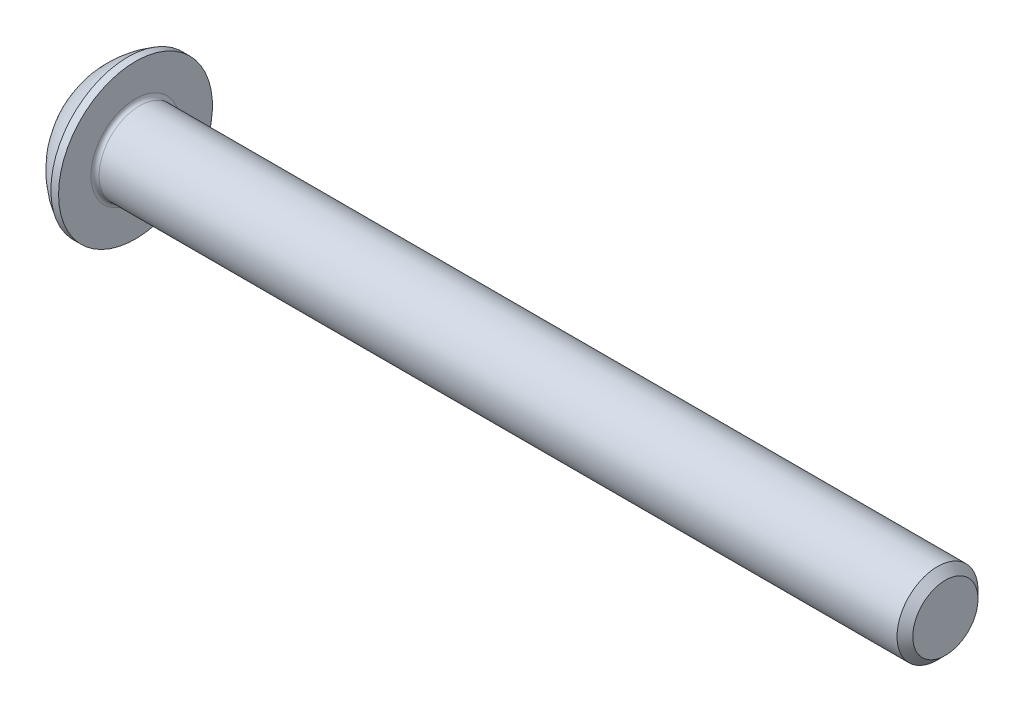
from build123d import *

# Parameters (mm, degrees)
FILLET1_R   = 0.2
HEX_2_DEPTH = 1.3


with BuildPart() as part:
    # BodySke → BaseBody (revolve)
    with BuildSketch(Plane.XY, mode=Mode.PRIVATE) as basebody_sk:
        with BuildLine():
            Line((42.2, 0), (42.2, 1.61))
            Line((42.2, 1.61), (41.81, 2))
            Line((41.81, 2), (2.2, 2))
            Line((2.2, 2), (2.2, 3.8))
            Line((2.2, 3.8), (1.82, 3.8))
            ThreePointArc((1.82, 3.8), (0.762013659, 2.991755338), (0, 1.9))
            Line((0, 1.9), (0, 0))
            Line((0, 0), (42.2, 0))
        make_face()
    revolve(basebody_sk.sketch.rotate(Axis((0, 0, 0), (1, 0, 0)), 90), axis=Axis((0, 0, 0), (1, 0, 0)))

    # Fillet1
    fillet1_edges = [part.edges().sort_by_distance(p)[0] for p in [
        (2.2, 0, -2),
    ]]
    fillet(fillet1_edges, radius=FILLET1_R)

    # Sketch2 → PreBroach (revolve, cut)
    with BuildSketch(Plane.XY, mode=Mode.PRIVATE) as prebroach_sk:
        Polygon((0, 1.25), (1.3, 1.25), (2.021687836, 0), (0, 0), align=None)
    revolve(prebroach_sk.sketch.rotate(Axis((0, 0, 0), (1, 0, 0)), 90), axis=Axis((0, 0, 0), (1, 0, 0)), mode=Mode.SUBTRACT)

    # Sketch3 → Hex 2 (cut)
    with BuildSketch(Plane(origin=(0, 0, 0), x_dir=(0, 0, -1), z_dir=(1, 0, 0))):
        Polygon((-1.25, -0.721687836), (-1.25, 0.721687836), (0, 1.443375673), (1.25, 0.721687836), (1.25, -0.721687836), (0, -1.443375673), align=None)
    extrude(amount=HEX_2_DEPTH, mode=Mode.SUBTRACT)


solid = part.part
